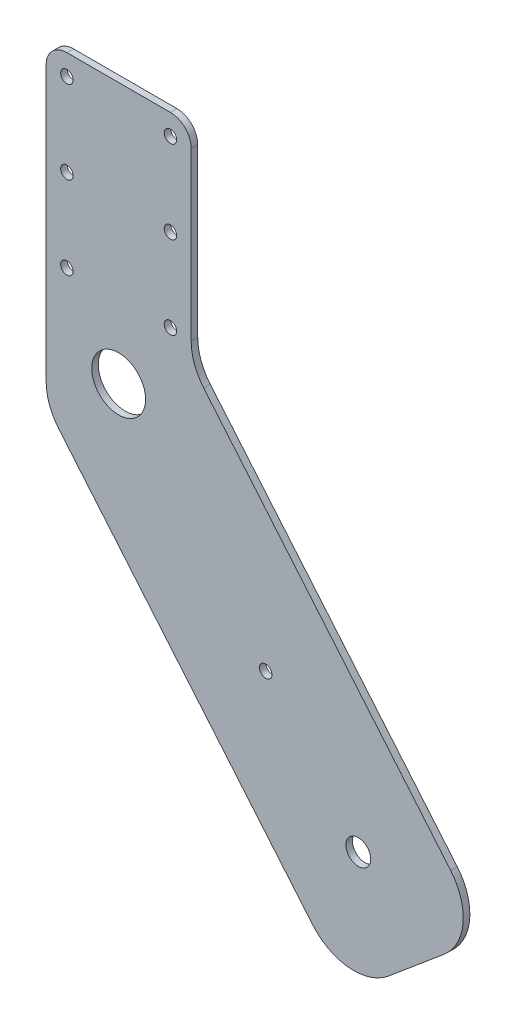
from build123d import *

# Parameters (mm, degrees)
SKETCH1_R           = 6.5
SKETCH1_R_2         = 1.5
SKETCH1_R_3         = 3
BOSS_EXTRUDE1_DEPTH = 1.5875
FILLET1_R           = 5
FILLET2_R           = 13


with BuildPart() as part:
    # Sketch1 → Boss-Extrude1 (new body)
    with BuildSketch(Plane.XY):
        Polygon((0, 0), (0, 50), (35, 50), (35, 0), (106.009911505, -84.626317146), (72.668567607, -112.603026514), (0, -26), align=None)
        with Locations((17.5, -13)):
            Circle(SKETCH1_R, mode=Mode.SUBTRACT)
        with Locations((5, 45)):
            Circle(SKETCH1_R_2, mode=Mode.SUBTRACT)
        with Locations((5, 25)):
            Circle(SKETCH1_R_2, mode=Mode.SUBTRACT)
        with Locations((5, 5)):
            Circle(SKETCH1_R_2, mode=Mode.SUBTRACT)
        with Locations(Location((30, 5, 0), (0, 0, 180))):
            Circle(SKETCH1_R_2, mode=Mode.SUBTRACT)
        with Locations(Location((30, 25, 0), (0, 0, 180))):
            Circle(SKETCH1_R_2, mode=Mode.SUBTRACT)
        with Locations(Location((30, 45, 0), (0, 0, 180))):
            Circle(SKETCH1_R_2, mode=Mode.SUBTRACT)
        with Locations((75.350884872, -81.943999881)):
            Circle(SKETCH1_R_3, mode=Mode.SUBTRACT)
        with Locations((53.004955752, -55.313158573)):
            Circle(SKETCH1_R_2, mode=Mode.SUBTRACT)
    extrude(amount=BOSS_EXTRUDE1_DEPTH)

    # Fillet1
    fillet1_edges = [part.edges().sort_by_distance(p)[0] for p in [
        (0, 50, 0.79375),
        (35, 50, 0.79375),
    ]]
    fillet(fillet1_edges, radius=FILLET1_R)

    # Fillet2
    fillet2_edges = [part.edges().sort_by_distance(p)[0] for p in [
        (35, 0, 0.79375),
        (106.009911505, -84.626317146, 0.79375),
        (72.668567607, -112.603026514, 0.79375),
        (0, -26, 0.79375),
    ]]
    fillet(fillet2_edges, radius=FILLET2_R)


solid = part.part
